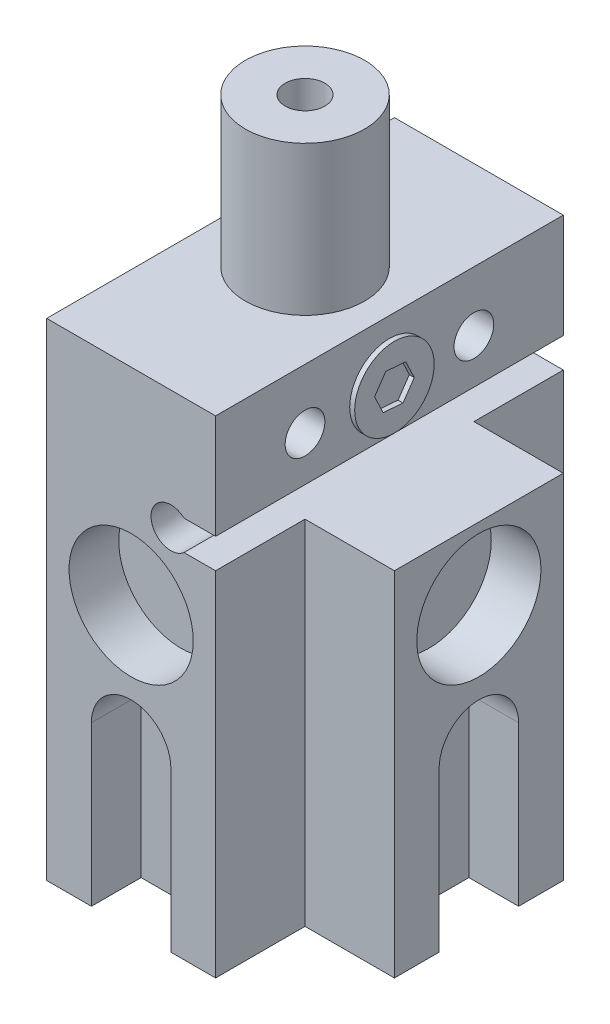
from build123d import *

# Parameters (mm, degrees)
SKETCH1_W           = 35
SKETCH1_H           = 49
BOSS_EXTRUDE1_DEPTH = 17
SKETCH2_R           = 2
CUT_EXTRUDE1_DEPTH  = 37
SKETCH3_W           = 17
SKETCH3_H           = 35.5
BOSS_EXTRUDE2_DEPTH = 9
SKETCH4_W           = 17
SKETCH4_H           = 35.5
BOSS_EXTRUDE3_DEPTH = 9
CUT_EXTRUDE2_DEPTH  = 59
SKETCH6_R           = 6.25
CUT_EXTRUDE3_DEPTH  = 5
CUT_EXTRUDE4_START  = -5
SKETCH7_R           = 6.25
CUT_EXTRUDE4_DEPTH  = 5
SKETCH8_R           = 6.25
CUT_EXTRUDE5_DEPTH  = 5
CUT_EXTRUDE6_START  = -5
SKETCH9_R           = 6.25
CUT_EXTRUDE6_DEPTH  = 5
SKETCH10_R          = 4
BOSS_EXTRUDE4_DEPTH = 0.5
CUT_EXTRUDE7_DEPTH  = 5
CUT_EXTRUDE8_START  = -5
CUT_EXTRUDE8_DEPTH  = 5
CUT_EXTRUDE9_DEPTH  = 5
CUT_EXTRUDE10_START = -5
CUT_EXTRUDE10_DEPTH = 5
SKETCH15_R          = 6
BOSS_EXTRUDE5_DEPTH = 15
SKETCH19_R          = 2
CUT_EXTRUDE11_DEPTH = 24


with BuildPart() as part:
    # Sketch1 → Boss-Extrude1 (new body)
    with BuildSketch(Plane(origin=(0, 0, 0), x_dir=(0, 0, -1), z_dir=(1, 0, 0))):
        with Locations((17.5, 24.5)):
            Rectangle(SKETCH1_W, SKETCH1_H)
    extrude(amount=BOSS_EXTRUDE1_DEPTH)

    # Sketch2 → Cut-Extrude1 (cut)
    with BuildSketch(Plane(origin=(17, 0, 0), x_dir=(0, 0, -1), z_dir=(1, 0, 0))):
        with Locations((9, 43)):
            Circle(SKETCH2_R)
        with Locations((26, 43)):
            Circle(SKETCH2_R)
    extrude(amount=-CUT_EXTRUDE1_DEPTH, mode=Mode.SUBTRACT)

    # Sketch3 → Boss-Extrude2 (add)
    with BuildSketch(Plane(origin=(17, 0, 0), x_dir=(0, 0, -1), z_dir=(1, 0, 0))):
        with Locations((17.5, 17.75)):
            Rectangle(SKETCH3_W, SKETCH3_H)
    extrude(amount=BOSS_EXTRUDE2_DEPTH)

    # Sketch4 → Boss-Extrude3 (add)
    with BuildSketch(Plane.ZY):
        with Locations((-17.5, 17.75)):
            Rectangle(SKETCH4_W, SKETCH4_H)
    extrude(amount=BOSS_EXTRUDE3_DEPTH)

    # Sketch5 → Cut-Extrude2 (cut)
    with BuildSketch(Plane.XY):
        with BuildLine():
            Line((17, 35.5), (13.822875656, 35.5))
            ThreePointArc((13.822875656, 35.5), (10.5, 37), (13.822875656, 38.5))
            Line((13.822875656, 38.5), (17, 38.5))
            Line((17, 38.5), (17, 35.5))
        make_face()
    extrude(amount=-CUT_EXTRUDE2_DEPTH, mode=Mode.SUBTRACT)

    # Sketch6 → Cut-Extrude3 (cut)
    with BuildSketch(Plane(origin=(26, 0, 0), x_dir=(0, 0, -1), z_dir=(1, 0, 0))):
        with Locations((17.5, 28.25)):
            Circle(SKETCH6_R)
    extrude(amount=-CUT_EXTRUDE3_DEPTH, mode=Mode.SUBTRACT)

    # Sketch7 → Cut-Extrude4 (cut)
    with BuildSketch(Plane.ZY.offset(9).offset(CUT_EXTRUDE4_START)):
        with Locations(Location((-17.5, 28.25, 0), (0, 0, 180))):
            Circle(SKETCH7_R)
    extrude(amount=CUT_EXTRUDE4_DEPTH, mode=Mode.SUBTRACT)

    # Sketch8 → Cut-Extrude5 (cut)
    with BuildSketch(Plane(origin=(0, 0, -35), x_dir=(-1, 0, 0), z_dir=(0, 0, -1))):
        with Locations(Location((-8.5, 28.25, 0), (0, 0, 90))):
            Circle(SKETCH8_R)
    extrude(amount=-CUT_EXTRUDE5_DEPTH, mode=Mode.SUBTRACT)

    # Sketch9 → Cut-Extrude6 (cut)
    with BuildSketch(Plane.XY.offset(CUT_EXTRUDE6_START)):
        with Locations(Location((8.5, 28.25, 0), (0, 0, 90))):
            Circle(SKETCH9_R)
    extrude(amount=CUT_EXTRUDE6_DEPTH, mode=Mode.SUBTRACT)

    # Sketch10 → Boss-Extrude4 (add)
    with BuildSketch(Plane(origin=(17, 0, 0), x_dir=(0, 0, -1), z_dir=(1, 0, 0))):
        with Locations(Location((17.5, 43, 0), (0, 0, 180))):
            Circle(SKETCH10_R)
        Polygon((18.636585466, 44.653193152), (16.636585466, 44.810908463), (15.5, 43.157715311), (16.363414534, 41.346806848), (18.363414534, 41.189091537), (19.5, 42.842284689), align=None, mode=Mode.SUBTRACT)
    extrude(amount=BOSS_EXTRUDE4_DEPTH)

    # Sketch11 → Cut-Extrude7 (cut)
    with BuildSketch(Plane(origin=(26, 0, 0), x_dir=(0, 0, -1), z_dir=(1, 0, 0))):
        with BuildLine():
            Line((13.5, 0), (21.5, 0))
            Line((21.5, 0), (21.5, 16))
            ThreePointArc((21.5, 16), (17.5, 20), (13.5, 16))
            Line((13.5, 16), (13.5, 0))
        make_face()
    extrude(amount=-CUT_EXTRUDE7_DEPTH, mode=Mode.SUBTRACT)

    # Sketch12 → Cut-Extrude8 (cut)
    with BuildSketch(Plane.ZY.offset(9).offset(CUT_EXTRUDE8_START)):
        with BuildLine():
            Line((-21.5, 0), (-13.5, 0))
            Line((-13.5, 0), (-13.5, 16))
            ThreePointArc((-13.5, 16), (-17.5, 20), (-21.5, 16))
            Line((-21.5, 16), (-21.5, 0))
        make_face()
    extrude(amount=CUT_EXTRUDE8_DEPTH, mode=Mode.SUBTRACT)

    # Sketch13 → Cut-Extrude9 (cut)
    with BuildSketch(Plane(origin=(0, 0, -35), x_dir=(-1, 0, 0), z_dir=(0, 0, -1))):
        with BuildLine():
            Line((-12.5, 0), (-4.5, 0))
            Line((-4.5, 0), (-4.5, 16))
            ThreePointArc((-4.5, 16), (-8.5, 20), (-12.5, 16))
            Line((-12.5, 16), (-12.5, 0))
        make_face()
    extrude(amount=-CUT_EXTRUDE9_DEPTH, mode=Mode.SUBTRACT)

    # Sketch14 → Cut-Extrude10 (cut)
    with BuildSketch(Plane.XY.offset(CUT_EXTRUDE10_START)):
        with BuildLine():
            Line((4.5, 0), (12.5, 0))
            Line((12.5, 0), (12.5, 16))
            ThreePointArc((12.5, 16), (8.5, 20), (4.5, 16))
            Line((4.5, 16), (4.5, 0))
        make_face()
    extrude(amount=CUT_EXTRUDE10_DEPTH, mode=Mode.SUBTRACT)

    # Sketch15 → Boss-Extrude5 (add)
    with BuildSketch(Plane(origin=(0, 49, 0), x_dir=(1, 0, 0), z_dir=(0, 1, 0))):
        with Locations(Location((8.5, 17.5, 0), (0, 0, 270))):
            Circle(SKETCH15_R)
    extrude(amount=BOSS_EXTRUDE5_DEPTH)

    # Sketch19 → Cut-Extrude11 (cut)
    with BuildSketch(Plane(origin=(0, 64, 0), x_dir=(1, 0, 0), z_dir=(0, 1, 0))):
        with Locations(Location((8.5, 17.5, 0), (0, 0, 270))):
            Circle(SKETCH19_R)
    extrude(amount=-CUT_EXTRUDE11_DEPTH, mode=Mode.SUBTRACT)


solid = part.part
